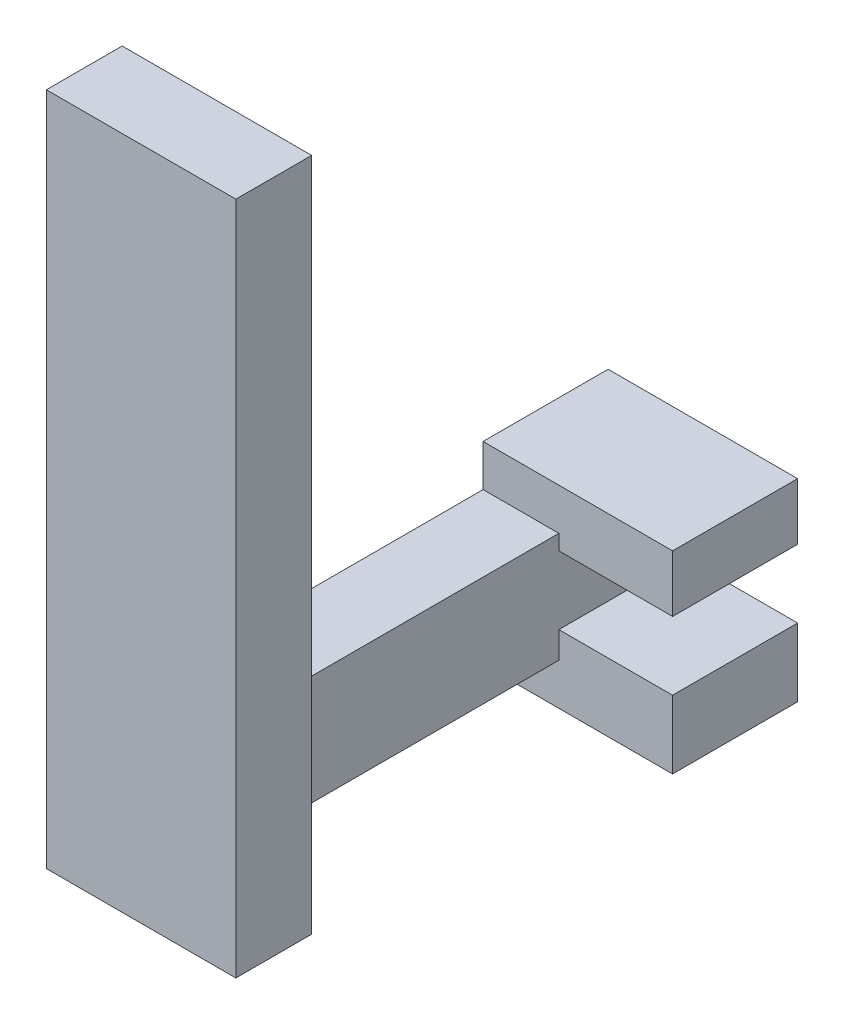
from build123d import *

# Parameters (mm, degrees)
SKETCH_1_W      = 2
SKETCH_1_H      = 12
EXTRUDE_1_DEPTH = 2.9
EXTRUDE_START   = -2
SKETCH_2_W      = 3.3
SKETCH_2_H      = 1.5
SKETCH_2_H_2    = 1.8
EXTRUDE_2_DEPTH = 5
SKETCH_3_W      = 10.525
SKETCH_3_H      = 2.9
EXTRUDE_3_DEPTH = 2
EXTRUDE_START_2 = -2.9
SKETCH_5_W      = 5
SKETCH_5_H      = 1
EXTRUDE_5_DEPTH = 17.8


with BuildPart() as part:
    # 草图1 → 凸台-拉伸1 (new body)
    with BuildSketch(Plane(origin=(0, 0, 0), x_dir=(1, 0, 0), z_dir=(0, 1, 0))):
        Rectangle(SKETCH_1_W, SKETCH_1_H)
    extrude(amount=EXTRUDE_1_DEPTH)

    # 草图2 → 凸台-拉伸2 (add)
    with BuildSketch(Plane(origin=(1, 0, 0), x_dir=(0, 0, -1), z_dir=(1, 0, 0)).offset(EXTRUDE_START)):
        with Locations((4.35, 3.25)):
            Rectangle(SKETCH_2_W, SKETCH_2_H)
        with Locations((4.35, -0.2)):
            Rectangle(SKETCH_2_W, SKETCH_2_H_2)
    extrude(amount=EXTRUDE_2_DEPTH)

    # 草图3 → 凸台-拉伸3 (add)
    with BuildSketch(Plane.ZY.offset(1)):
        with Locations((2.5625, 1.45)):
            Rectangle(SKETCH_3_W, SKETCH_3_H)
    extrude(amount=-EXTRUDE_3_DEPTH)

    # 草图5 → 凸台-拉伸5 (add)
    with BuildSketch(Plane(origin=(0, 2.9, 0), x_dir=(1, 0, 0), z_dir=(0, 1, 0)).offset(EXTRUDE_START_2)):
        with Locations((1.5, -7.325)):
            Rectangle(SKETCH_5_W, SKETCH_5_H)
        with Locations((1.5, -8.325)):
            Rectangle(SKETCH_5_W, SKETCH_5_H)
    extrude(amount=EXTRUDE_5_DEPTH)


solid = part.part
